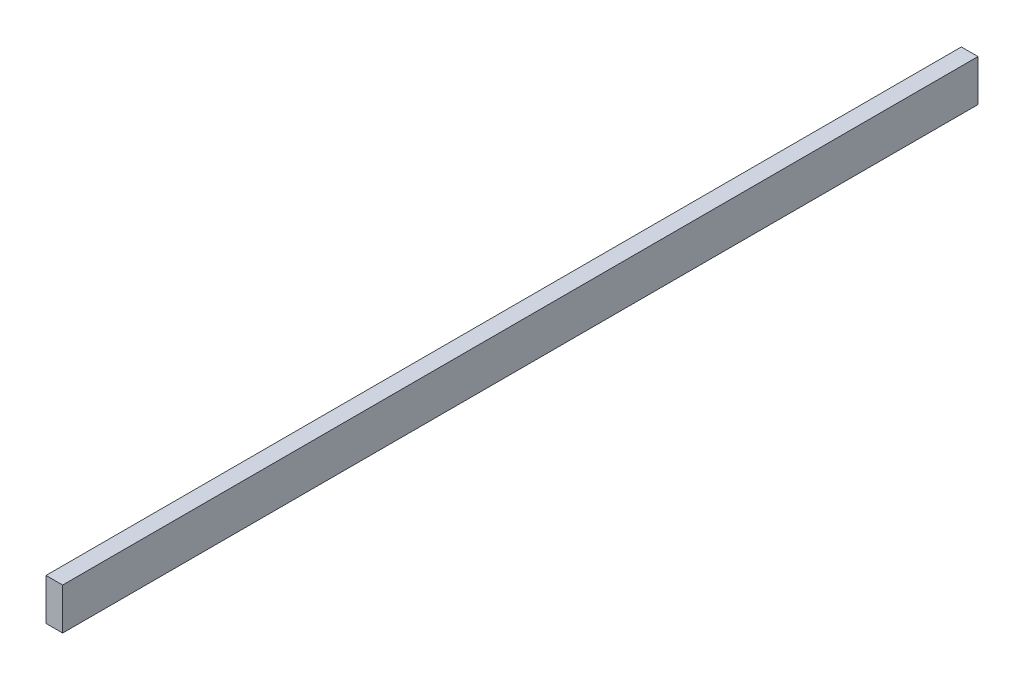
from build123d import *

# Parameters (mm, degrees)
SKETCH2_W           = 550
SKETCH2_H           = 25
BOSS_EXTRUDE1_DEPTH = 10


with BuildPart() as part:
    # Sketch2 → Boss-Extrude1 (new body)
    with BuildSketch(Plane(origin=(0, 0, 0), x_dir=(0, 0, -1), z_dir=(1, 0, 0))):
        with Locations((275, 12.5)):
            Rectangle(SKETCH2_W, SKETCH2_H)
    extrude(amount=BOSS_EXTRUDE1_DEPTH)


solid = part.part
